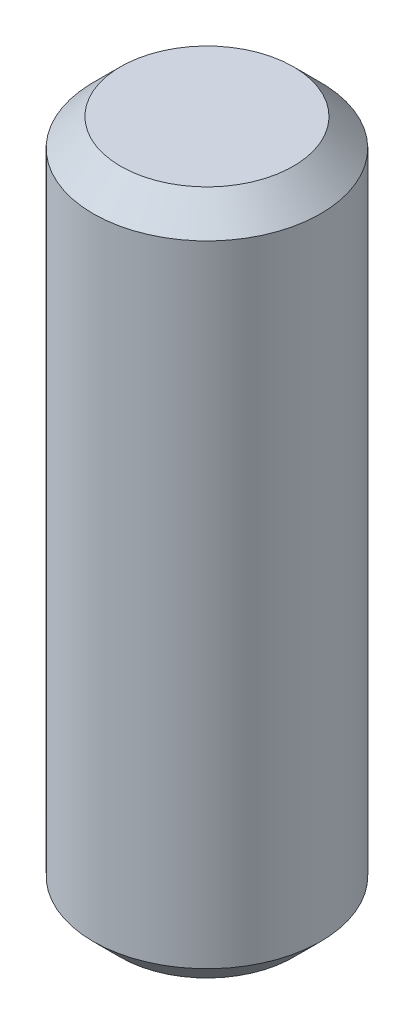
from build123d import *

# Parameters (mm, degrees)
SKETCH1_R           = 4.15
BOSS_EXTRUDE1_DEPTH = 25
CHAMFER2_SIZE       = 1


with BuildPart() as part:
    # Sketch1 → Boss-Extrude1 (new body)
    with BuildSketch(Plane(origin=(0, 0, 0), x_dir=(1, 0, 0), z_dir=(0, 1, 0))):
        with Locations(Location((0, 0, 0), (0, 0, 270))):
            Circle(SKETCH1_R)
    extrude(amount=BOSS_EXTRUDE1_DEPTH)

    # Chamfer2
    chamfer2_edges = [part.edges().sort_by_distance(p)[0] for p in [
        (0, 0, -4.15),
        (0, 25, -4.15),
    ]]
    chamfer(chamfer2_edges, length=CHAMFER2_SIZE)


solid = part.part
